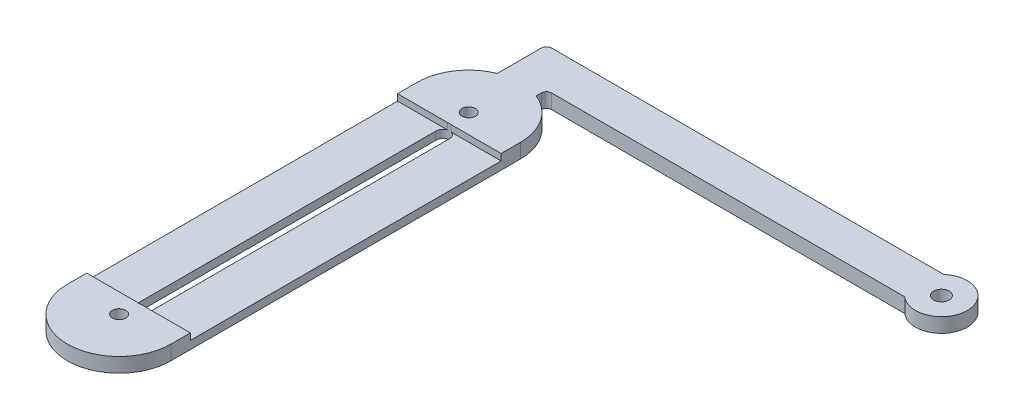
from build123d import *

# Parameters (mm, degrees)
SKETCH1_R           = 3.302
BOSS_EXTRUDE1_DEPTH = 7.112
SKETCH2_W           = 50.8
SKETCH2_H           = 152.4
CUT_EXTRUDE1_DEPTH  = 3.175
SKETCH3_R           = 3.81
BOSS_EXTRUDE2_DEPTH = 7.112
FILLET1_R           = 2.54


with BuildPart() as part:
    # Sketch1 → Boss-Extrude1 (new body)
    with BuildSketch(Plane(origin=(0, 0, 0), x_dir=(1, 0, 0), z_dir=(0, 1, 0))):
        with BuildLine():
            Line((25.4, 85.725), (25.4, -85.725))
            ThreePointArc((25.4, -85.725), (0, -111.125), (-25.4, -85.725))
            Line((-25.4, -85.725), (-25.4, 85.725))
            ThreePointArc((-25.4, 85.725), (0, 111.125), (25.4, 85.725))
        make_face()
        with Locations(Location((0, 85.725, 0), (0, 0, 270))):
            Circle(SKETCH1_R, mode=Mode.SUBTRACT)
        with Locations(Location((0, -85.725, 0), (0, 0, 270))):
            Circle(SKETCH1_R, mode=Mode.SUBTRACT)
        with BuildLine():
            Line((3.302, 73.025), (3.302, -73.025))
            ThreePointArc((3.302, -73.025), (0, -76.327), (-3.302, -73.025))
            Line((-3.302, -73.025), (-3.302, 73.025))
            ThreePointArc((-3.302, 73.025), (0, 76.327), (3.302, 73.025))
        make_face(mode=Mode.SUBTRACT)
    extrude(amount=BOSS_EXTRUDE1_DEPTH)

    # Sketch2 → Cut-Extrude1 (cut)
    with BuildSketch(Plane(origin=(0, 7.112, 0), x_dir=(1, 0, 0), z_dir=(0, 1, 0))):
        Rectangle(SKETCH2_W, SKETCH2_H)
    extrude(amount=-CUT_EXTRUDE1_DEPTH, mode=Mode.SUBTRACT)

    # Sketch3 → Boss-Extrude2 (add)
    with BuildSketch(Plane(origin=(0, 0, 0), x_dir=(1, 0, 0), z_dir=(0, 1, 0))):
        with BuildLine():
            Line((-9.525, 85.725), (-9.525, 133.35))
            Line((-9.525, 133.35), (185.274739587, 133.35))
            ThreePointArc((185.274739587, 133.35), (206.375, 123.825), (185.274739587, 114.3))
            Line((185.274739587, 114.3), (9.525, 114.3))
            Line((9.525, 114.3), (9.525, 85.725))
            Line((9.525, 85.725), (0, 95.25))
            Line((0, 95.25), (-9.525, 85.725))
        make_face()
        with Locations(Location((193.675, 123.825, 0), (0, 0, 270))):
            Circle(SKETCH3_R, mode=Mode.SUBTRACT)
    extrude(amount=BOSS_EXTRUDE2_DEPTH)

    # Fillet1
    fillet1_edges = [part.edges().sort_by_distance(p)[0] for p in [
        (-9.525, 3.556, -133.35),
        (9.525, 3.556, -114.3),
    ]]
    fillet(fillet1_edges, radius=FILLET1_R)


solid = part.part
